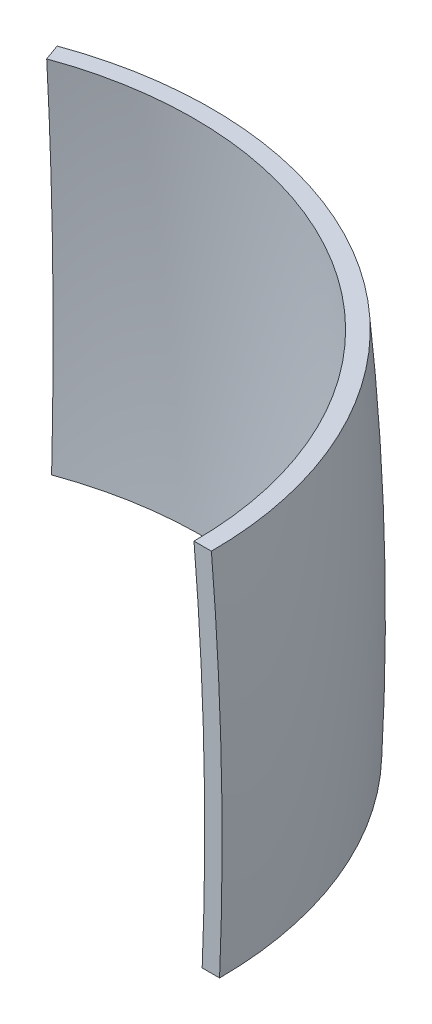
from build123d import *

# Parameters (mm, degrees)
REVOLVE_1_ANGLE = 110


with BuildPart() as part:
    # Эскиз1 → Повернуть1 (revolve)
    with BuildSketch(Plane.XY):
        with BuildLine():
            Line((45, 14.9986189), (43, 14.996781384))
            ThreePointArc((43, 14.996781384), (43.209079003, 36.012493393), (42.059326302, 56.997772375))
            Line((42.059326302, 56.997772375), (44.059326302, 56.997772375))
            ThreePointArc((44.059326302, 56.997772375), (45.205684243, 36.013336783), (45, 14.9986189))
        make_face()
    revolve(axis=Axis((0, 0, 0), (0, 1, 0)), revolution_arc=REVOLVE_1_ANGLE)


solid = part.part
